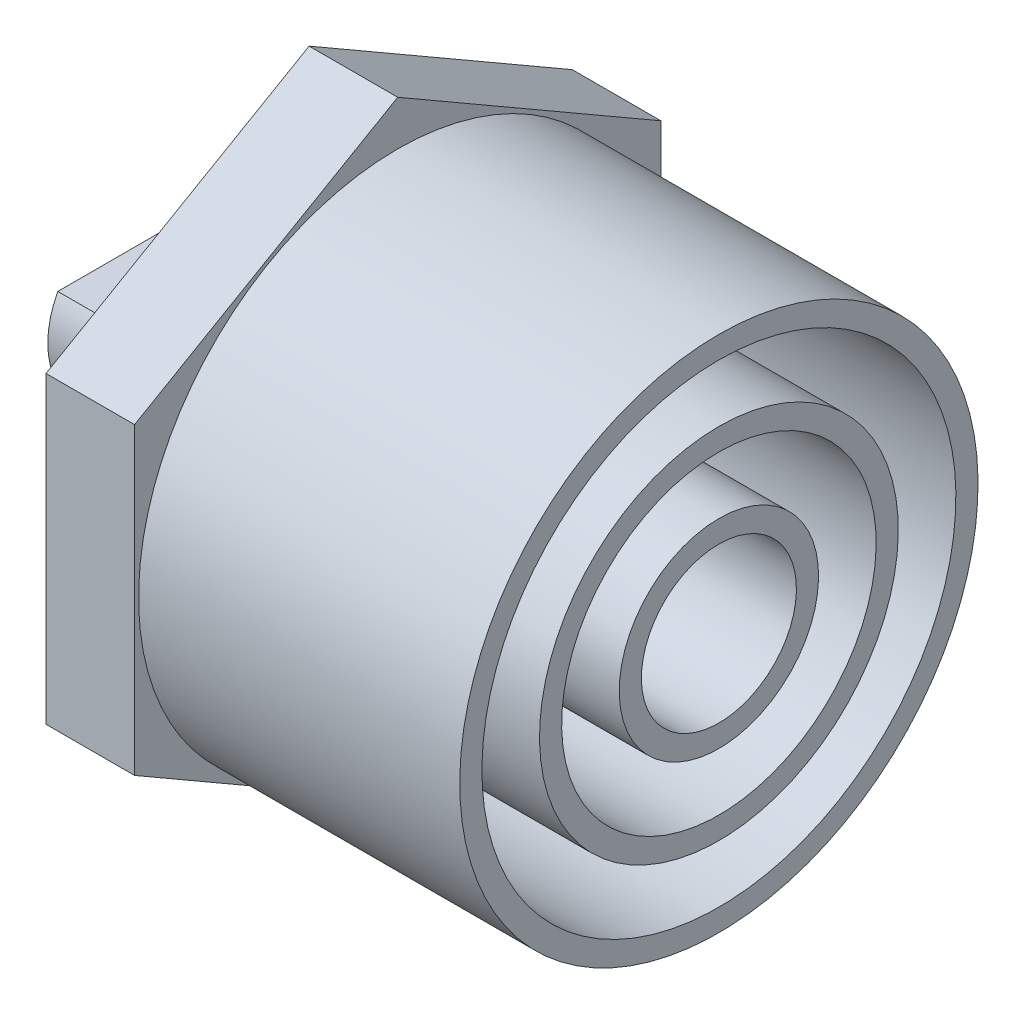
from build123d import *

# Parameters (mm, degrees)
BOSS_EXTRUDE1_DEPTH = 1
BOSS_EXTRUDE2_START = -1
SKETCH2_3_R         = 5.85
BOSS_EXTRUDE2_DEPTH = 1
SKETCH3_W           = 4
SKETCH3_H           = 1.8
BOSS_EXTRUDE3_DEPTH = 1.9
CUT_EXTRUDE1_DEPTH  = 4


with BuildPart() as part:
    # Sketch1 → Revolve1 (revolve)
    with BuildSketch(Plane.XY):
        Polygon((0, 0), (0, 5.85), (8.25, 5.85), (8.25, 5.35), (1, 5.35), (1, 4.05), (8.25, 4.05), (8.25, 3.55), (1, 3.55), (1, 2.25), (8.25, 2.25), (8.25, 1.75), (1, 1.75), (1, 0), align=None)
    revolve(axis=Axis((1, 0, 0), (-1, 0, 0)))

    # Sketch2 → Boss-Extrude1 (add)
    with BuildSketch(Plane.ZY):
        Polygon((0, 6.858921198), (-5.94, 3.429460599), (-5.94, -3.429460599), (0, -6.858921198), (5.94, -3.429460599), (5.94, 3.429460599), align=None)
    extrude(amount=BOSS_EXTRUDE1_DEPTH)

    # Sketch2<3> → Boss-Extrude2 (add)
    with BuildSketch(Plane.ZY.offset(BOSS_EXTRUDE2_START)):
        Polygon((5.94, -3.429460599), (5.94, 3.429460599), (0, 6.858921198), (-5.94, 3.429460599), (-5.94, -3.429460599), (0, -6.858921198), align=None)
        with Locations(Location((0, 0, 0), (0, 0, 90))):
            Circle(SKETCH2_3_R, mode=Mode.SUBTRACT)
    extrude(amount=BOSS_EXTRUDE2_DEPTH)

    # Sketch3 → Boss-Extrude3 (add, symmetric)
    with BuildSketch(Plane.XY):
        with Locations((-3, 0)):
            Rectangle(SKETCH3_W, SKETCH3_H)
    extrude(amount=BOSS_EXTRUDE3_DEPTH, both=True)

    # Sketch4 → Cut-Extrude1 (cut)
    with BuildSketch(Plane.ZY.offset(5)):
        with BuildLine():
            Line((-1.9, 0.9), (-1.9, 0))
            ThreePointArc((-1.9, 0), (-1.842458697, 0.464053822), (-1.673320053, 0.9))
            Line((-1.673320053, 0.9), (-1.9, 0.9))
        make_face()
        with BuildLine():
            Line((-1.9, 0), (-1.9, -0.9))
            Line((-1.9, -0.9), (-1.673320053, -0.9))
            ThreePointArc((-1.673320053, -0.9), (-1.842458697, -0.464053822), (-1.9, 0))
        make_face()
        with BuildLine():
            ThreePointArc((1.9, 0), (1.842458697, -0.464053822), (1.673320053, -0.9))
            Line((1.673320053, -0.9), (1.9, -0.9))
            Line((1.9, -0.9), (1.9, 0))
        make_face()
        with BuildLine():
            ThreePointArc((1.673320053, 0.9), (1.842458697, 0.464053822), (1.9, 0))
            Line((1.9, 0), (1.9, 0.9))
            Line((1.9, 0.9), (1.673320053, 0.9))
        make_face()
    extrude(amount=-CUT_EXTRUDE1_DEPTH, mode=Mode.SUBTRACT)


solid = part.part
